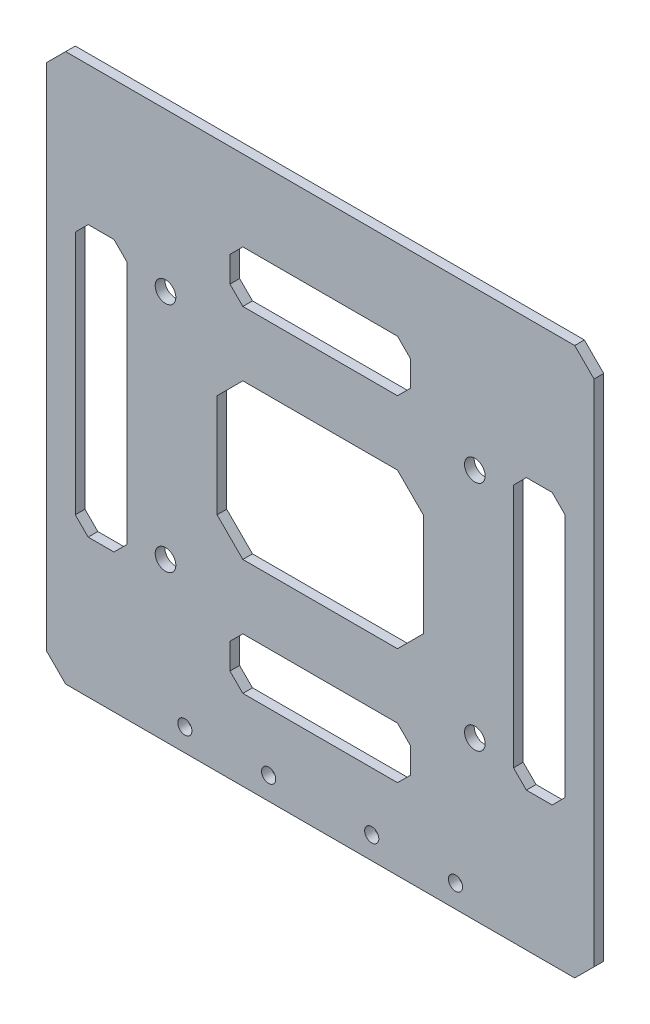
from build123d import *

# Parameters (mm, degrees)
SKETCH_1_R            = 1.6
SKETCH_1_R_2          = 1.1
F_85_1P5MM_DEPTH      = 1.5
CUT_EXTRUDE_384_DEPTH = 1.5


with BuildPart() as part:
    # 草图1 → 85方雷达盖板_1p5mm (new body)
    with BuildSketch(Plane.XY):
        Polygon((-42.5, -39.5), (-39.5, -42.5), (39.5, -42.5), (42.5, -39.5), (42.5, 39.5), (39.5, 42.5), (-39.5, 42.5), (-42.5, 39.5), align=None)
        with Locations((-24, -18)):
            Circle(SKETCH_1_R, mode=Mode.SUBTRACT)
        with Locations((-24, 18)):
            Circle(SKETCH_1_R, mode=Mode.SUBTRACT)
        with Locations((24, -18)):
            Circle(SKETCH_1_R, mode=Mode.SUBTRACT)
        with Locations((24, 18)):
            Circle(SKETCH_1_R, mode=Mode.SUBTRACT)
        with Locations((-21, -39)):
            Circle(SKETCH_1_R_2, mode=Mode.SUBTRACT)
        with Locations((-8, -39)):
            Circle(SKETCH_1_R_2, mode=Mode.SUBTRACT)
        with Locations((8, -39)):
            Circle(SKETCH_1_R_2, mode=Mode.SUBTRACT)
        with Locations((21, -39)):
            Circle(SKETCH_1_R_2, mode=Mode.SUBTRACT)
    extrude(amount=F_85_1P5MM_DEPTH)

    # 草图4 → Cut-Extrude 384 (cut)
    with BuildSketch(Plane.XY):
        Polygon((-12, -12), (12, -12), (16, -8), (16, 8), (12, 12), (-12, 12), (-16, 8), (-16, -8), align=None)
        Polygon((-32, -21), (-36, -21), (-38, -19), (-38, 19), (-36, 21), (-32, 21), (-30, 19), (-30, -19), align=None)
        Polygon((32, -21), (36, -21), (38, -19), (38, 19), (36, 21), (32, 21), (30, 19), (30, -19), align=None)
        Polygon((-12, -22), (12, -22), (14, -24), (14, -28), (12, -30), (-12, -30), (-14, -28), (-14, -24), align=None)
        Polygon((-12, 22), (12, 22), (14, 24), (14, 28), (12, 30), (-12, 30), (-14, 28), (-14, 24), align=None)
    extrude(amount=CUT_EXTRUDE_384_DEPTH, mode=Mode.SUBTRACT)


solid = part.part
